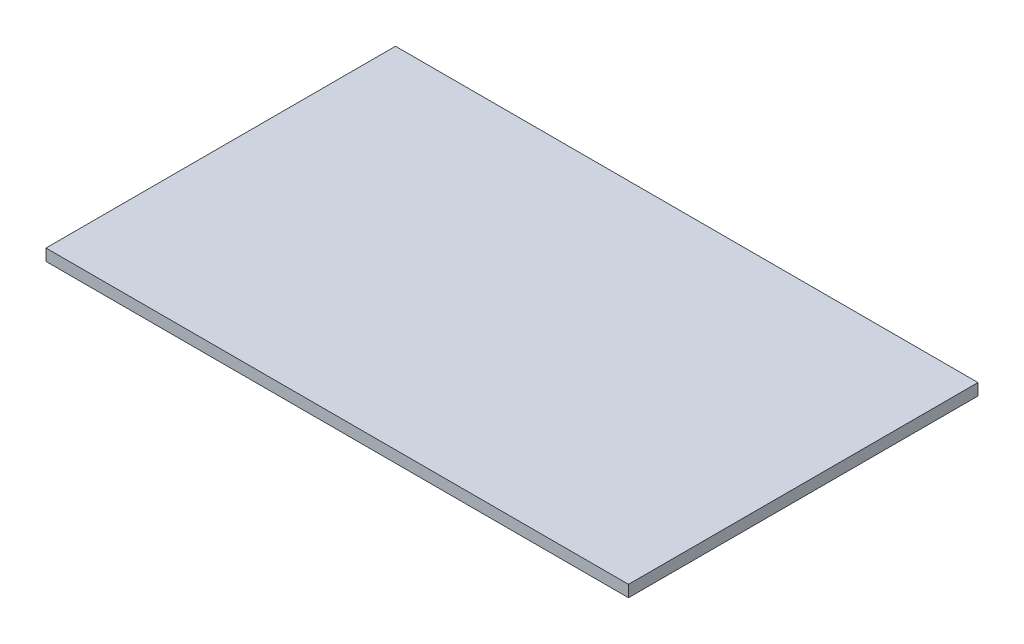
from build123d import *

# Parameters (mm, degrees)
CROQUIS1_W              = 500
CROQUIS1_H              = 300
SALIENTE_EXTRUIR1_DEPTH = 10


with BuildPart() as part:
    # Croquis1 → Saliente-Extruir1 (new body)
    with BuildSketch(Plane(origin=(0, 0, 0), x_dir=(1, 0, 0), z_dir=(0, 1, 0))):
        Rectangle(CROQUIS1_W, CROQUIS1_H)
    extrude(amount=SALIENTE_EXTRUIR1_DEPTH)


solid = part.part
